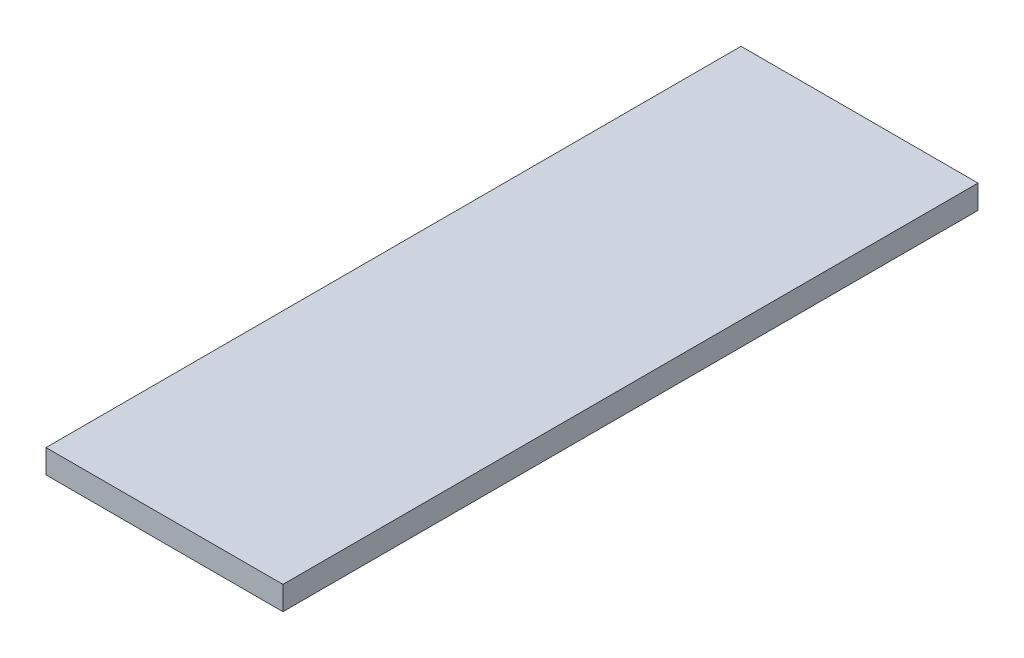
from build123d import *

# Parameters (mm, degrees)
SKETCH1_W           = 30
SKETCH1_H           = 88
BOSS_EXTRUDE1_DEPTH = 3


with BuildPart() as part:
    # Sketch1 → Boss-Extrude1 (new body)
    with BuildSketch(Plane(origin=(0, 0, 0), x_dir=(1, 0, 0), z_dir=(0, 1, 0))):
        with Locations((15, 44)):
            Rectangle(SKETCH1_W, SKETCH1_H)
    extrude(amount=BOSS_EXTRUDE1_DEPTH)


solid = part.part
